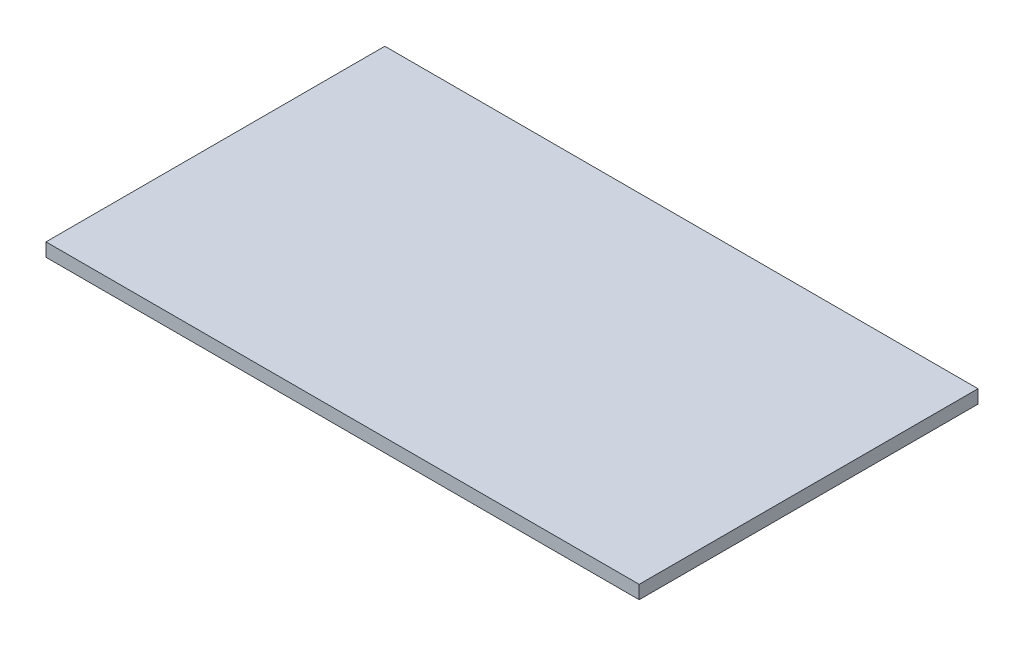
from build123d import *

# Parameters (mm, degrees)
SKETCH1_W           = 369.1255
SKETCH1_H           = 210.8454
BOSS_EXTRUDE1_DEPTH = 8.3312


with BuildPart() as part:
    # Sketch1 → Boss-Extrude1 (new body)
    with BuildSketch(Plane(origin=(0, 0, 0), x_dir=(1, 0, 0), z_dir=(0, 1, 0))):
        with Locations((-29.797014585, -68.505567707)):
            Rectangle(SKETCH1_W, SKETCH1_H)
    extrude(amount=BOSS_EXTRUDE1_DEPTH)


solid = part.part
